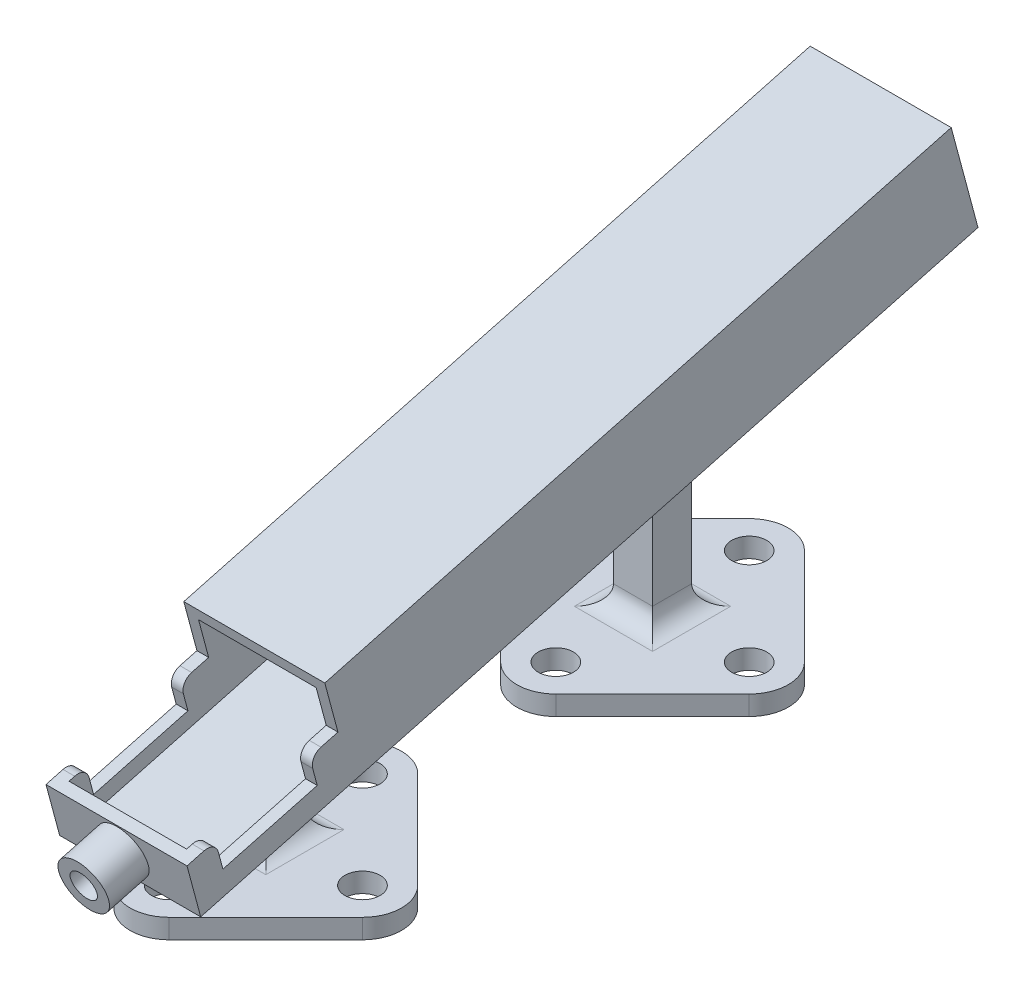
from build123d import *

# Parameters (mm, degrees)
SKETCH1_R                = 4.5
BOSS_EXTRUDE1_DEPTH      = 2.5
SKETCH2_W                = 10
SKETCH2_H                = 45
BOSS_EXTRUDE2_DEPTH      = 5
CUT_EXTRUDE1_DEPTH       = 147.126229678
CUT_EXTRUDE1_DEPTH_BACK  = 147.126229678
BOSS_EXTRUDE3_DEPTH      = 15.05
FILLET1_R                = 5
FILLET2_R                = 5
BOSS_EXTRUDE4_DEPTH      = 16.5
BOSS_EXTRUDE4_DEPTH_BACK = 2.000004
SKETCH6_W                = 36.1
SKETCH6_H                = 156
SKETCH6_W_2              = 30.1
SKETCH6_H_2              = 150
BOSS_EXTRUDE5_DEPTH      = 5
SKETCH8_W                = 36.1
SKETCH8_H                = 116
BOSS_EXTRUDE6_DEPTH      = 3
CUT_EXTRUDE2_REACH       = 183.097
SKETCH10_W               = 30.1
SKETCH10_H               = 21.5
SKETCH11_W               = 36.1
SKETCH11_H               = 40
CUT_EXTRUDE3_DEPTH       = 5
SKETCH12_W               = 3
SKETCH12_H               = 25
CUT_EXTRUDE4_DEPTH       = 7.5
CUT_EXTRUDE5_REACH       = 195.973
SKETCH13_R               = 3.4
SKETCH14_R               = 6.4
SKETCH14_R_2             = 3.4
BOSS_EXTRUDE7_DEPTH      = 10.5
FILLET3_R                = 3
SKETCH15_W               = 36.1
SKETCH15_H               = 26.5
SKETCH15_W_2             = 30.1
SKETCH15_H_2             = 21.5
BOSS_EXTRUDE8_DEPTH      = 50


with BuildPart() as part:
    # Sketch1 → Boss-Extrude1 (new, symmetric)
    with BuildSketch(Plane(origin=(0, 0, 0), x_dir=(1, 0, 0), z_dir=(0, 1, 0))):
        with BuildLine():
            Line((-31.821067812, 7.071067812), (-7.071067812, 31.821067812))
            ThreePointArc((-7.071067812, 31.821067812), (0, 34.75), (7.071067812, 31.821067812))
            Line((7.071067812, 31.821067812), (31.821067812, 7.071067812))
            ThreePointArc((31.821067812, 7.071067812), (34.75, 0), (31.821067812, -7.071067812))
            Line((31.821067812, -7.071067812), (7.071067812, -31.821067812))
            ThreePointArc((7.071067812, -31.821067812), (0, -34.75), (-7.071067812, -31.821067812))
            Line((-7.071067812, -31.821067812), (-31.821067812, -7.071067812))
            ThreePointArc((-31.821067812, -7.071067812), (-34.75, 0), (-31.821067812, 7.071067812))
        make_face()
        with Locations(Location((0, 24.75, 0), (0, 0, 270))):
            Circle(SKETCH1_R, mode=Mode.SUBTRACT)
        with Locations(Location((24.75, 0, 0), (0, 0, 270))):
            Circle(SKETCH1_R, mode=Mode.SUBTRACT)
        with Locations(Location((0, -24.75, 0), (0, 0, 270))):
            Circle(SKETCH1_R, mode=Mode.SUBTRACT)
        with Locations(Location((-24.75, 0, 0), (0, 0, 270))):
            Circle(SKETCH1_R, mode=Mode.SUBTRACT)
    extrude(amount=BOSS_EXTRUDE1_DEPTH, both=True)


with BuildPart() as body_2:
    # Mirror3: mirrored copy
    add(part.part.mirror(Plane.XY.offset(49.5)))


with BuildPart() as body_3:
    # Sketch2 → Boss-Extrude2 (new, symmetric)
    with BuildSketch(Plane(origin=(0, 0, 0), x_dir=(0, 0, -1), z_dir=(1, 0, 0))):
        with Locations((-99, 25)):
            Rectangle(SKETCH2_W, SKETCH2_H)
    extrude(amount=BOSS_EXTRUDE2_DEPTH, both=True)


with BuildPart() as body_4:
    # Mirror5: mirrored copy
    add(body_3.part.mirror(Plane.XY.offset(49.5)))


with BuildPart() as cut_extrude1_tool:
    # Sketch3 → Cut-Extrude1 (new, two sides: drawn at the far end of the back side and taken through both)
    with BuildSketch(Plane(origin=(0, 0, 0), x_dir=(0, 0, -1), z_dir=(1, 0, 0)).offset(-CUT_EXTRUDE1_DEPTH_BACK)):
        Polygon((-398.060619113, -61.293305417), (-104, 17.5), (5, 46.706461975), (299.060619113, 125.499767392), (141.474008279, 713.621005618), (-555.647229947, 526.827932809), align=None)
    extrude(amount=CUT_EXTRUDE1_DEPTH + CUT_EXTRUDE1_DEPTH_BACK)


with BuildPart() as body_3_1:
    add(body_3.part)

    # Cut-Extrude1: cut by cut_extrude1_tool
    add(cut_extrude1_tool.part, mode=Mode.SUBTRACT)


with BuildPart() as body_4_1:
    add(body_4.part)

    # Cut-Extrude1: cut by cut_extrude1_tool
    add(cut_extrude1_tool.part, mode=Mode.SUBTRACT)

    # Combine2: union part
    add(part.part)

    # Fillet2
    fillet2_edges = [body_4_1.edges().sort_by_distance(p)[0] for p in [
        (-5, 2.5, 0),
        (0, 2.5, 5),
        (0, 2.5, -5),
        (5, 2.5, 0),
    ]]
    fillet(fillet2_edges, radius=FILLET2_R)


with BuildPart() as body_5:
    # Sketch4 → Boss-Extrude3 (new, symmetric)
    with BuildSketch(Plane(origin=(0, 0, 0), x_dir=(0, 0, -1), z_dir=(1, 0, 0))):
        Polygon((-130.821067812, 10.31331654), (14.067806131, 49.136173305), (13.550168041, 51.068024958), (-131.338705902, 12.245168192), align=None)
    extrude(amount=BOSS_EXTRUDE3_DEPTH, both=True)



with BuildPart() as body_2_1:
    add(body_2.part)

    # Combine1: union body 3
    add(body_3_1.part)

    # Fillet1
    fillet1_edges = [body_2_1.edges().sort_by_distance(p)[0] for p in [
        (0, 2.5, 94),
        (5, 2.5, 99),
        (-5, 2.5, 99),
        (0, 2.5, 104),
    ]]
    fillet(fillet1_edges, radius=FILLET1_R)


with BuildPart() as body_5_1:
    add(body_5.part)

    add(body_2_1.part)  # Boss-Extrude4 merges body 2

    add(body_4_1.part)  # Boss-Extrude4 merges body 4
    # Sketch6 → Boss-Extrude4 (add, two sides: drawn at the far end of the back side and taken through both)
    with BuildSketch(Plane(origin=(0, 44.259573936, 11.859317093), x_dir=(1, 0, 0), z_dir=(0, 0.96592582628907, 0.2588190451025143)).offset(-BOSS_EXTRUDE4_DEPTH_BACK)):
        with Locations((0, -48.694165284)):
            Rectangle(SKETCH6_W, SKETCH6_H)
        with Locations((0, -48.694165284)):
            Rectangle(SKETCH6_W_2, SKETCH6_H_2, mode=Mode.SUBTRACT)
    extrude(amount=BOSS_EXTRUDE4_DEPTH + BOSS_EXTRUDE4_DEPTH_BACK)

    # Sketch7 → Boss-Extrude5 (add)
    with BuildSketch(Plane(origin=(0, 60.197350069, 16.129831338), x_dir=(1, 0, 0), z_dir=(0, 0.96592582628907, 0.25881904510251436))):
        Polygon((15.05, 26.305834716), (15.05, -86.694165284), (18.05, -86.694165284), (18.05, 29.305834716), (-18.05, 29.305834716), (-18.05, -86.694165284), (-15.05, -86.694165284), (-15.05, 26.305834716), align=None)
    extrude(amount=BOSS_EXTRUDE5_DEPTH)

    # Sketch8 → Boss-Extrude6 (add)
    with BuildSketch(Plane(origin=(0, 65.026979201, 17.423926563), x_dir=(1, 0, 0), z_dir=(0, 0.96592582628907, 0.25881904510251436))):
        with Locations((0, -28.694165284)):
            Rectangle(SKETCH8_W, SKETCH8_H)
    extrude(amount=BOSS_EXTRUDE6_DEPTH)

    # Sketch10 → Cut-Extrude2 (cut, up to next)
    with BuildSketch(Plane(origin=(0, 6.808451022, -25.409485135), x_dir=(1, 0, 0), z_dir=(0, -0.2588190451025143, 0.96592582628907)), mode=Mode.PRIVATE) as cut_extrude2_sk1:
        with Locations((0, 56.570882651)):
            Rectangle(SKETCH10_W, SKETCH10_H)
    cut_extrude2_tool1 = extrude(cut_extrude2_sk1.sketch, amount=-CUT_EXTRUDE2_REACH, mode=Mode.PRIVATE) & body_5_1.part
    add(cut_extrude2_tool1.solids().sort_by_distance((0, 61.451728, -10.767863))[0], mode=Mode.SUBTRACT)

    # Sketch11 → Cut-Extrude3 (cut)
    with BuildSketch(Plane(origin=(0, 60.197350069, 16.129831338), x_dir=(1, 0, 0), z_dir=(0, 0.96592582628907, 0.25881904510251436))):
        with Locations((0, -106.694165284)):
            Rectangle(SKETCH11_W, SKETCH11_H)
    extrude(amount=-CUT_EXTRUDE3_DEPTH, mode=Mode.SUBTRACT)

    # Sketch12 → Cut-Extrude4 (cut)
    with BuildSketch(Plane(origin=(0, 55.367720938, 14.835736112), x_dir=(1, 0, 0), z_dir=(0, 0.96592582628907, 0.25881904510251447))):
        with Locations((-16.55, -106.694165284)):
            Rectangle(SKETCH12_W, SKETCH12_H)
        with Locations((16.55, -106.694165284)):
            Rectangle(SKETCH12_W, SKETCH12_H)
    extrude(amount=-CUT_EXTRUDE4_DEPTH, mode=Mode.SUBTRACT)

    # Sketch13 → Cut-Extrude5 (cut, up to next)
    with BuildSketch(Plane(origin=(0, -32.790862879, 122.377166288), x_dir=(1, 0, 0), z_dir=(0, -0.2588190451025143, 0.96592582628907)), mode=Mode.PRIVATE) as cut_extrude5_sk1:
        with Locations(Location((0, 50.570882651, 0), (0, 0, 270))):
            Circle(SKETCH13_R)
    cut_extrude5_tool1 = extrude(cut_extrude5_sk1.sketch, amount=-CUT_EXTRUDE5_REACH, mode=Mode.PRIVATE) & body_5_1.part
    add(cut_extrude5_tool1.solids().sort_by_distance((0, 16.056859, 135.465874))[0], mode=Mode.SUBTRACT)

    # Sketch14 → Boss-Extrude7 (add)
    with BuildSketch(Plane(origin=(0, -32.790862879, 122.377166288), x_dir=(1, 0, 0), z_dir=(0, -0.2588190451025143, 0.96592582628907))):
        with Locations(Location((0, 50.570882651, 0), (0, 0, 270))):
            Circle(SKETCH14_R)
        with Locations(Location((0, 50.570882651, 0), (0, 0, 270))):
            Circle(SKETCH14_R_2, mode=Mode.SUBTRACT)
    extrude(amount=BOSS_EXTRUDE7_DEPTH)

    # Fillet3
    fillet3_edges = [body_5_1.edges().sort_by_distance(p)[0] for p in [
        (-16.55, 24.518000898, 129.968458702),
        (-16.55, 30.988477025, 105.820313045),
        (16.55, 24.518000898, 129.968458702),
        (16.55, 30.988477025, 105.820313045),
    ]]
    fillet(fillet3_edges, radius=FILLET3_R)

    # Sketch15 → Boss-Extrude8 (add)
    with BuildSketch(Plane(origin=(0, 7.584908157, -28.307262614), x_dir=(-1, 0, 0), z_dir=(0, 0.2588190451025143, -0.96592582628907))):
        with Locations((0, 57.070882651)):
            Rectangle(SKETCH15_W, SKETCH15_H)
        with Locations((0, 56.570882651)):
            Rectangle(SKETCH15_W_2, SKETCH15_H_2, mode=Mode.SUBTRACT)
    extrude(amount=BOSS_EXTRUDE8_DEPTH)


solid = body_5_1.part
